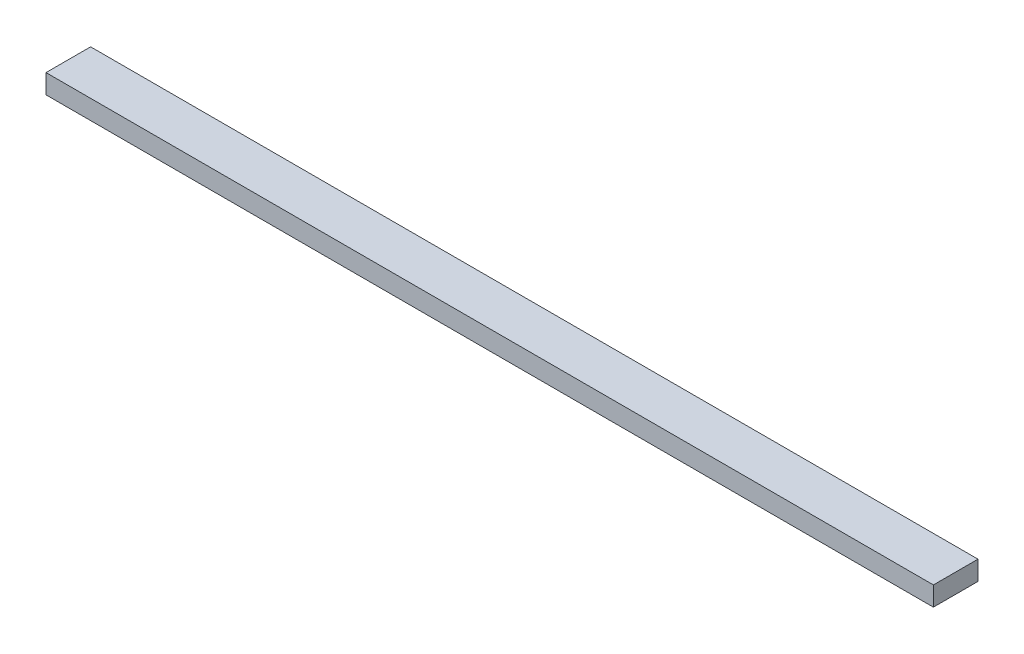
from build123d import *

# Parameters (mm, degrees)
SKETCH1_W           = 88.10625
SKETCH1_H           = 38.1
BOSS_EXTRUDE1_DEPTH = 1752.6


with BuildPart() as part:
    # Sketch1 → Boss-Extrude1 (new body)
    with BuildSketch(Plane(origin=(0, 0, 0), x_dir=(0, 0, -1), z_dir=(1, 0, 0))):
        Rectangle(SKETCH1_W, SKETCH1_H)
    extrude(amount=BOSS_EXTRUDE1_DEPTH)


solid = part.part
